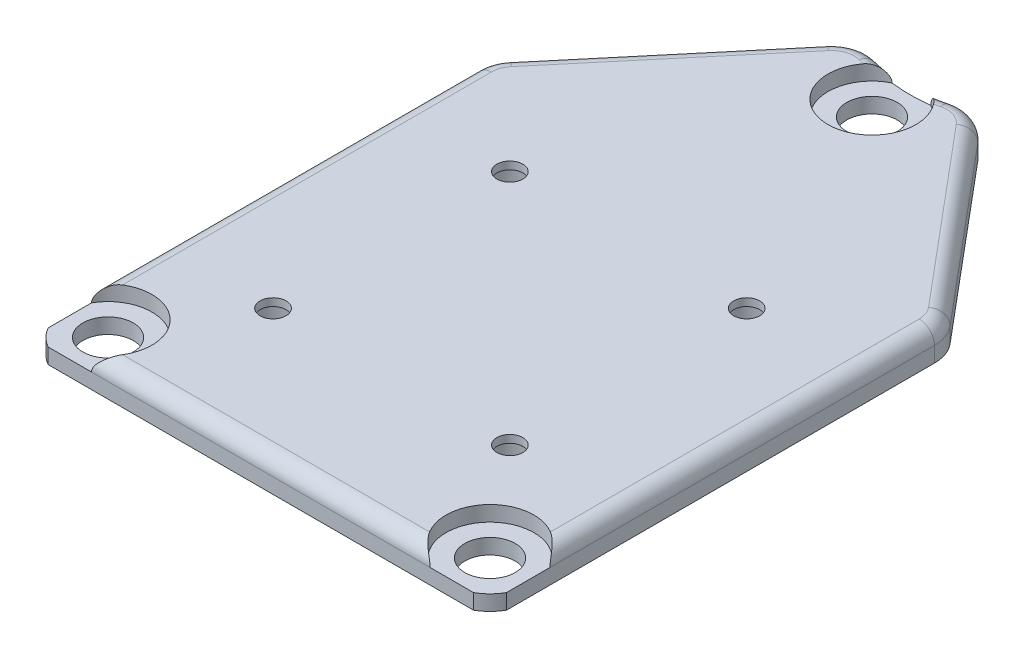
from build123d import *

# Parameters (mm, degrees)
BOSS_EXTRUDE1_DEPTH            = 4
HOLE1_D                        = 6.6
HOLE1_CBORE_D                  = 11.5
HOLE1_CBORE_DEPTH              = 2
CUT_EXTRUDE3_DEPTH             = 110.27488275
CBORE_FOR_M3_SHCS1_D           = 3.4
CBORE_FOR_M3_SHCS1_CBORE_D     = 6.5
CBORE_FOR_M3_SHCS1_CBORE_DEPTH = 3
FILLET4_R                      = 5
FILLET3_R                      = 2


with BuildPart() as part:
    # Sketch2 → Boss-Extrude1 (new body)
    with BuildSketch(Plane(origin=(0, 0, 0), x_dir=(1, 0, 0), z_dir=(0, 1, 0))):
        with BuildLine():
            Line((-30, -45), (-7.721394619, -18.449391999))
            ThreePointArc((-7.721394619, -18.449391999), (0, -20), (7.721394619, -18.449391999))
            Line((7.721394619, -18.449391999), (30, -45))
            Line((30, -45), (30, -105))
            Line((30, -105), (-30, -105))
            Line((-30, -105), (-30, -45))
        make_face()
    extrude(amount=BOSS_EXTRUDE1_DEPTH)

    # Hole1 (through all)
    with Locations(Plane(origin=(0, 4, 0), x_dir=(1, 0, 0), z_dir=(0, 1, 0))):
        with Locations((-25, -100), (25, -100), (0, -25)):
            CounterBoreHole(HOLE1_D / 2, HOLE1_CBORE_D / 2, HOLE1_CBORE_DEPTH)

    # Sketch5 → Cut-Extrude3 (cut, through all)
    with BuildSketch(Plane(origin=(0, 4, 0), x_dir=(1, 0, 0), z_dir=(0, 1, 0))):
        with BuildLine():
            Line((-30, -102.839454173), (-30, -105))
            Line((-30, -105), (-27.839454173, -105))
            ThreePointArc((-27.839454173, -105), (-29.065863992, -104.065863992), (-30, -102.839454173))
        make_face()
        with BuildLine():
            Line((30, -105), (27.839454173, -105))
            ThreePointArc((27.839454173, -105), (29.065863992, -104.065863992), (30, -102.839454173))
            Line((30, -102.839454173), (30, -105))
        make_face()
    extrude(amount=-CUT_EXTRUDE3_DEPTH, mode=Mode.SUBTRACT)

    # CBORE for M3 SHCS1 (through all)
    with Locations(Plane(origin=(0, 0, 0), x_dir=(-1, 0, 0), z_dir=(0, -1, 0))):
        with Locations((-15.5, -56.9), (15.5, -56.9), (15.5, -87.9), (-15.5, -87.9)):
            CounterBoreHole(CBORE_FOR_M3_SHCS1_D / 2, CBORE_FOR_M3_SHCS1_CBORE_D / 2, CBORE_FOR_M3_SHCS1_CBORE_DEPTH)

    # Fillet4
    fillet4_edges = [part.edges().sort_by_distance(p)[0] for p in [
        (-30, 2, 45),
        (-7.721394619, 2, 18.449391999),
        (7.721394619, 2, 18.449391999),
        (30, 2, 45),
    ]]
    fillet(fillet4_edges, radius=FILLET4_R)

    # Fillet3
    fillet3_edges = [part.edges().sort_by_distance(p)[0] for p in [
        (30, 4, 71.990198499),
        (0, 4, 105),
        (-30, 4, 71.990198499),
        (-19.362432028, 4, 32.322640153),
        (-29.698463104, 4, 45.109750455),
        (-3.699480023, 4, 19.654868292),
        (-7.607899613, 4, 19.497501458),
        (29.698463104, 4, 45.109750455),
        (19.362432028, 4, 32.322640153),
        (7.607899613, 4, 19.497501458),
        (3.699480023, 4, 19.654868292),
    ]]
    fillet(fillet3_edges, radius=FILLET3_R)


solid = part.part
